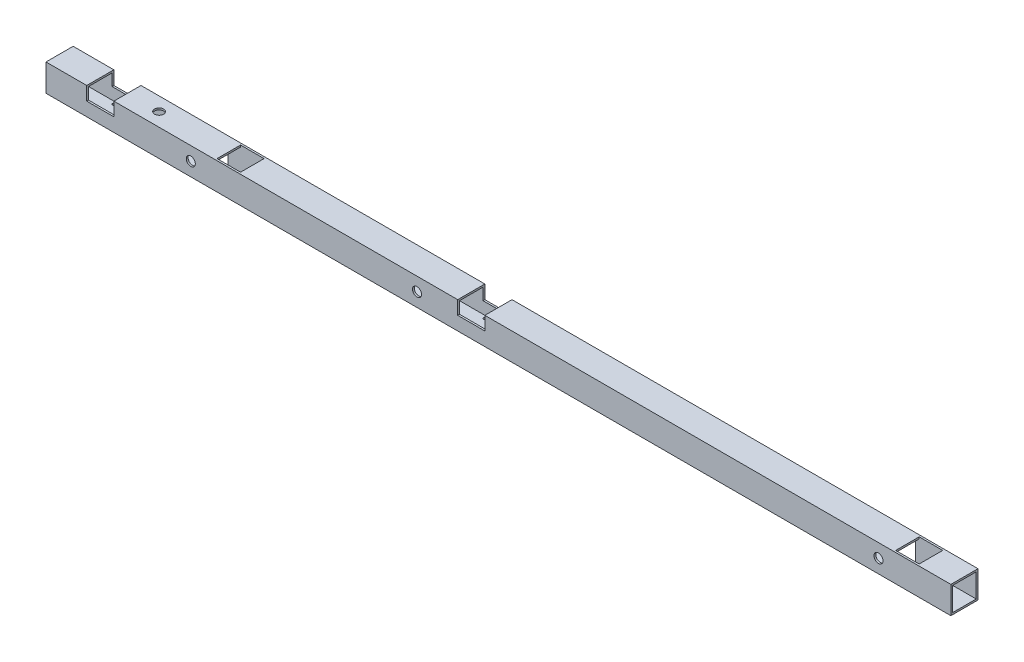
from build123d import *

# Parameters (mm, degrees)
SKETCH_2_W          = 30
SKETCH_2_H          = 30
SKETCH_2_W_2        = 26
SKETCH_2_H_2        = 26
EXTRUDE_2_DEPTH     = 1000
SKETCH_3_W          = 30
SKETCH_3_H          = 15
CUT_EXTRUDE_1_DEPTH = 30
SKETCH_4_W          = 26
SKETCH_4_H          = 26
SKETCH_4_W_2        = 11
SKETCH_4_H_2        = 12
CUT_EXTRUDE_2_DEPTH = 15
SKETCH_5_R          = 5
CUT_EXTRUDE_3_DEPTH = 15
SKETCH_6_R          = 1.5
CUT_EXTRUDE_4_DEPTH = 15
SKETCH_8_R          = 5
SKETCH_8_W          = 26
SKETCH_8_H          = 26
CUT_EXTRUDE_5_DEPTH = 15
SKETCH_9_R          = 5
SKETCH_9_W          = 26
SKETCH_9_H          = 26
CUT_EXTRUDE_6_DEPTH = 15


with BuildPart() as part:
    # 草图2 → 凸台-拉伸2 (new body)
    with BuildSketch(Plane(origin=(0, 0, 0), x_dir=(0, 0, -1), z_dir=(1, 0, 0))):
        Rectangle(SKETCH_2_W, SKETCH_2_H)
        Rectangle(SKETCH_2_W_2, SKETCH_2_H_2, mode=Mode.SUBTRACT)
    extrude(amount=EXTRUDE_2_DEPTH)

    # 草图3 → 切除-拉伸1 (cut)
    with BuildSketch(Plane(origin=(0, 0, -15), x_dir=(-1, 0, 0), z_dir=(0, 0, -1))):
        with Locations((-470, 7.5)):
            Rectangle(SKETCH_3_W, SKETCH_3_H)
        with Locations((-60, 7.5)):
            Rectangle(SKETCH_3_W, SKETCH_3_H)
    extrude(amount=-CUT_EXTRUDE_1_DEPTH, mode=Mode.SUBTRACT)

    # 草图4 → 切除-拉伸2 (cut)
    with BuildSketch(Plane(origin=(0, 0, -15), x_dir=(-1, 0, 0), z_dir=(0, 0, -1))):
        with Locations((-920, 0)):
            Rectangle(SKETCH_4_W, SKETCH_4_H)
        with Locations((-410, 0)):
            Rectangle(SKETCH_4_W, SKETCH_4_H)
        with Locations((-160, 0)):
            Rectangle(SKETCH_4_W, SKETCH_4_H)
        with Locations((-870.5, 0)):
            Rectangle(SKETCH_4_W_2, SKETCH_4_H_2)
    extrude(amount=-CUT_EXTRUDE_2_DEPTH, mode=Mode.SUBTRACT)

    # 草图5 → 切除-拉伸3 (cut)
    with BuildSketch(Plane.XY.offset(15)):
        with Locations((160, 0)):
            Circle(SKETCH_5_R)
        with Locations((410, 0)):
            Circle(SKETCH_5_R)
        with Locations((920, 0)):
            Circle(SKETCH_5_R)
    extrude(amount=-CUT_EXTRUDE_3_DEPTH, mode=Mode.SUBTRACT)

    # 草图6 → 切除-拉伸4 (cut)
    with BuildSketch(Plane.XZ.offset(15)):
        with Locations(Location((50, 10, 0), (0, 0, 270))):
            Circle(SKETCH_6_R)
        with Locations(Location((70, 10, 0), (0, 0, 270))):
            Circle(SKETCH_6_R)
        with Locations(Location((50, -10, 0), (0, 0, 270))):
            Circle(SKETCH_6_R)
        with Locations(Location((70, -10, 0), (0, 0, 270))):
            Circle(SKETCH_6_R)
        with Locations(Location((460, 10, 0), (0, 0, 270))):
            Circle(SKETCH_6_R)
        with Locations(Location((480, 10, 0), (0, 0, 270))):
            Circle(SKETCH_6_R)
        with Locations(Location((460, -10, 0), (0, 0, 270))):
            Circle(SKETCH_6_R)
        with Locations(Location((480, -10, 0), (0, 0, 270))):
            Circle(SKETCH_6_R)
    extrude(amount=-CUT_EXTRUDE_4_DEPTH, mode=Mode.SUBTRACT)

    # 草图8 → 切除-拉伸5 (cut)
    with BuildSketch(Plane(origin=(0, 15, 0), x_dir=(1, 0, 0), z_dir=(0, 1, 0))):
        with Locations(Location((110, 0, 0), (0, 0, 270))):
            Circle(SKETCH_8_R)
        with Locations((950, 0)):
            Rectangle(SKETCH_8_W, SKETCH_8_H)
        with Locations((200, 0)):
            Rectangle(SKETCH_8_W, SKETCH_8_H)
    extrude(amount=-CUT_EXTRUDE_5_DEPTH, mode=Mode.SUBTRACT)

    # 草图9 → 切除-拉伸6 (cut)
    with BuildSketch(Plane.XZ.offset(15)):
        with Locations(Location((950, 0, 0), (0, 0, 270))):
            Circle(SKETCH_9_R)
        with Locations(Location((200, 0, 0), (0, 0, 270))):
            Circle(SKETCH_9_R)
        with Locations((110, 0)):
            Rectangle(SKETCH_9_W, SKETCH_9_H)
    extrude(amount=-CUT_EXTRUDE_6_DEPTH, mode=Mode.SUBTRACT)


solid = part.part
